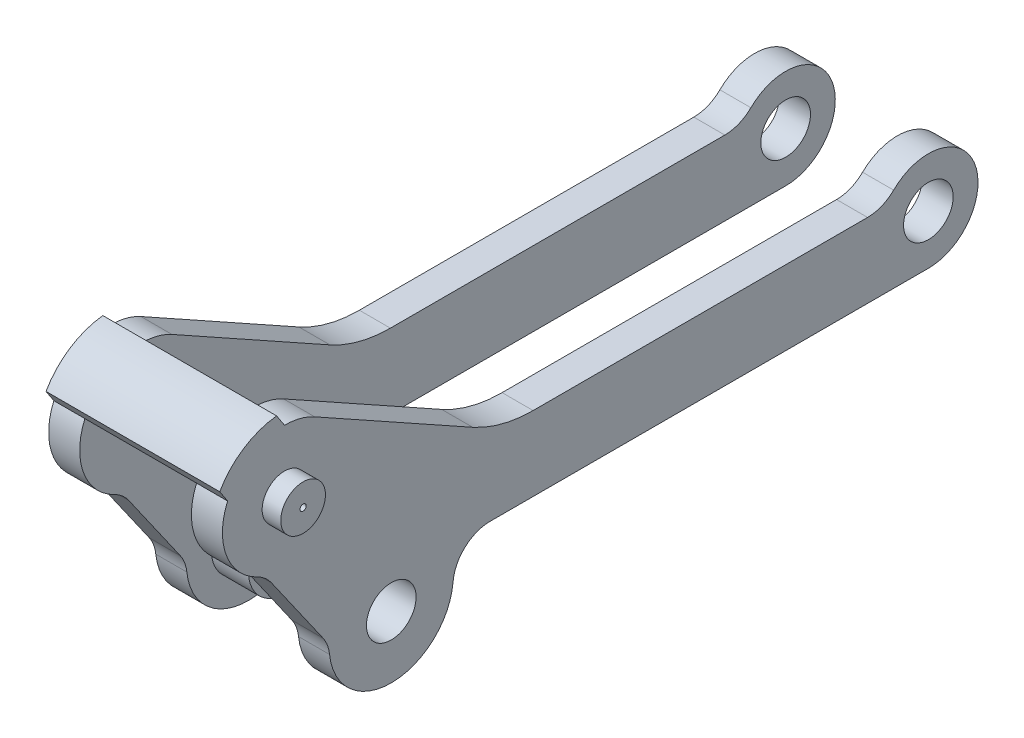
from build123d import *

# Parameters (mm, degrees)
EXTRUDE_1_DEPTH          = 2.5
SKETCH_1_4_R             = 3
EXTRUDE_2_DEPTH          = 3
CUT_EXTRUDE_1_DEPTH      = 51.090903435
CUT_EXTRUDE_1_DEPTH_BACK = 51.090903435
SKETCH_1_3_R             = 2
FILLET_1_R               = 3
EXTRUDE_START            = -2.5
SKETCH_2_R               = 2
EXTRUDE_3_DEPTH          = 2.5
SKETCH_2_3_R             = 1.8
EXTRUDE_4_DEPTH          = 1.5
EXTRUDE_6_DEPTH          = 2.5
EXTRUDE_START_2          = -7
EXTRUDE_5_DEPTH          = 7
FILLET_3_R               = 10
SKETCH_5_R               = 0.25
CUT_EXTRUDE_2_DEPTH      = 2


with BuildPart() as part:
    # 草图1 → 凸台-拉伸1 (new body)
    with BuildSketch(Plane(origin=(0, 0, 0), x_dir=(0, 0, -1), z_dir=(1, 0, 0))):
        with BuildLine():
            Line((40.737143614, 0), (0, 0))
            Line((0, 0), (2.48051592, -3.542543867))
            ThreePointArc((2.48051592, -3.542543867), (4.165783411, -4.487079684), (5.367176995, -6))
            Line((5.367176995, -6), (44.201245229, -6))
            ThreePointArc((44.201245229, -6), (40.737143614, -4), (40.737143614, 0))
        make_face()
        with BuildLine():
            Line((2.48051592, -3.542543867), (0, 0))
            Line((0, 0), (-2.681672007, 3.829824531))
            ThreePointArc((-2.681672007, 3.829824531), (-4.811127311, -0.102785303), (-9.234888361, -0.758786959))
            Line((-9.234888361, -0.758786959), (-4.072700434, -8.131155358))
            ThreePointArc((-4.072700434, -8.131155358), (-1.94324513, -4.198545524), (2.48051592, -3.542543867))
        make_face()
        with BuildLine():
            ThreePointArc((48.201245229, -2), (45.23652141, 1.863703305), (40.737143614, 0))
            Line((40.737143614, 0), (44.201245229, 0))
            ThreePointArc((44.201245229, 0), (45.615458792, -0.585786438), (46.201245229, -2))
            ThreePointArc((46.201245229, -2), (45.615458792, -3.414213562), (44.201245229, -4))
            Line((44.201245229, -4), (44.201245229, -6))
            ThreePointArc((44.201245229, -6), (47.029672354, -4.828427125), (48.201245229, -2))
        make_face()
        with BuildLine():
            Line((44.201245229, 0), (40.737143614, 0))
            ThreePointArc((40.737143614, 0), (40.737143614, -4), (44.201245229, -6))
            Line((44.201245229, -6), (44.201245229, -4))
            ThreePointArc((44.201245229, -4), (42.201245229, -2), (44.201245229, 0))
        make_face()
        with BuildLine():
            ThreePointArc((5.367176995, -6), (4.165783411, -4.487079684), (2.48051592, -3.542543867))
            Line((2.48051592, -3.542543867), (4.201245229, -6))
            Line((4.201245229, -6), (5.367176995, -6))
        make_face()
        with BuildLine():
            Line((4.201245229, -6), (2.48051592, -3.542543867))
            ThreePointArc((2.48051592, -3.542543867), (-1.94324513, -4.198545524), (-4.072700434, -8.131155358))
            Line((-4.072700434, -8.131155358), (-2.351971125, -10.588611491))
            Line((-2.351971125, -10.588611491), (-1.532819081, -10.015035054))
            ThreePointArc((-1.532819081, -10.015035054), (-0.796092257, -5.836849613), (3.382093185, -6.573576436))
            Line((3.382093185, -6.573576436), (4.201245229, -6))
        make_face()
        with BuildLine():
            ThreePointArc((-9.234888361, -0.758786959), (-4.811127311, -0.102785303), (-2.681672007, 3.829824531))
            Line((-2.681672007, 3.829824531), (-4.402401316, 6.287280664))
            Line((-4.402401316, 6.287280664), (-6.040705405, 5.140127792))
            ThreePointArc((-6.040705405, 5.140127792), (-5.771575592, 4.594386518), (-5.679009493, 3.992974919))
            ThreePointArc((-5.679009493, 3.992974919), (-7.077597894, 2.085541017), (-9.317313582, 2.845822046))
            Line((-9.317313582, 2.845822046), (-10.95561767, 1.698669174))
            Line((-10.95561767, 1.698669174), (-9.234888361, -0.758786959))
        make_face()
        with BuildLine():
            Line((-4.402401316, 6.287280664), (-2.681672007, 3.829824531))
            ThreePointArc((-2.681672007, 3.829824531), (-2.679675166, 3.911388863), (-2.679009493, 3.992974919))
            ThreePointArc((-2.679009493, 3.992974919), (-10.613341245, 8.041394014), (-9.234888361, -0.758786959))
            Line((-9.234888361, -0.758786959), (-10.95561767, 1.698669174))
            Line((-10.95561767, 1.698669174), (-9.317313582, 2.845822046))
            ThreePointArc((-9.317313582, 2.845822046), (-8.826162366, 5.631279008), (-6.040705405, 5.140127792))
            Line((-6.040705405, 5.140127792), (-4.402401316, 6.287280664))
        make_face()
        with BuildLine():
            ThreePointArc((46.201245229, -2), (45.615458792, -0.585786438), (44.201245229, 0))
            Line((44.201245229, 0), (44.201245229, -4))
            ThreePointArc((44.201245229, -4), (45.615458792, -3.414213562), (46.201245229, -2))
        make_face()
        with BuildLine():
            Line((44.201245229, -4), (44.201245229, 0))
            ThreePointArc((44.201245229, 0), (42.201245229, -2), (44.201245229, -4))
        make_face()
        with BuildLine():
            Line((5.367176995, -6), (4.201245229, -6))
            Line((4.201245229, -6), (3.382093185, -6.573576436))
            ThreePointArc((3.382093185, -6.573576436), (3.785787904, -7.392188347), (3.924637052, -8.294305745))
            ThreePointArc((3.924637052, -8.294305745), (1.826754451, -11.155456598), (-1.532819081, -10.015035054))
            Line((-1.532819081, -10.015035054), (-2.351971125, -10.588611491))
            Line((-2.351971125, -10.588611491), (-4.072700434, -8.131155358))
            ThreePointArc((-4.072700434, -8.131155358), (0.843050996, -13.293640073), (5.924637052, -8.294305745))
            ThreePointArc((5.924637052, -8.294305745), (5.783273678, -7.113776143), (5.367176995, -6))
        make_face()
        with BuildLine():
            ThreePointArc((3.924637052, -8.294305745), (3.785787904, -7.392188347), (3.382093185, -6.573576436))
            Line((3.382093185, -6.573576436), (2.562941141, -7.147152873))
            ThreePointArc((2.562941141, -7.147152873), (2.832070954, -7.692894146), (2.924637052, -8.294305745))
            ThreePointArc((2.924637052, -8.294305745), (1.526048651, -10.201739647), (-0.713667036, -9.441458618))
            Line((-0.713667036, -9.441458618), (-1.532819081, -10.015035054))
            ThreePointArc((-1.532819081, -10.015035054), (1.826754451, -11.155456598), (3.924637052, -8.294305745))
        make_face()
        with BuildLine():
            Line((2.562941141, -7.147152873), (3.382093185, -6.573576436))
            ThreePointArc((3.382093185, -6.573576436), (-0.796092257, -5.836849613), (-1.532819081, -10.015035054))
            Line((-1.532819081, -10.015035054), (-0.713667036, -9.441458618))
            ThreePointArc((-0.713667036, -9.441458618), (-0.222515821, -6.656001657), (2.562941141, -7.147152873))
        make_face()
        with BuildLine():
            ThreePointArc((-5.679009493, 3.992974919), (-5.771575592, 4.594386518), (-6.040705405, 5.140127792))
            Line((-6.040705405, 5.140127792), (-9.317313582, 2.845822046))
            ThreePointArc((-9.317313582, 2.845822046), (-7.077597894, 2.085541017), (-5.679009493, 3.992974919))
        make_face()
        with BuildLine():
            Line((-9.317313582, 2.845822046), (-6.040705405, 5.140127792))
            ThreePointArc((-6.040705405, 5.140127792), (-8.826162366, 5.631279008), (-9.317313582, 2.845822046))
        make_face()
        with BuildLine():
            ThreePointArc((2.924637052, -8.294305745), (2.832070954, -7.692894146), (2.562941141, -7.147152873))
            Line((2.562941141, -7.147152873), (-0.713667036, -9.441458618))
            ThreePointArc((-0.713667036, -9.441458618), (1.526048651, -10.201739647), (2.924637052, -8.294305745))
        make_face()
        with BuildLine():
            Line((-0.713667036, -9.441458618), (2.562941141, -7.147152873))
            ThreePointArc((2.562941141, -7.147152873), (-0.222515821, -6.656001657), (-0.713667036, -9.441458618))
        make_face()
    extrude(amount=EXTRUDE_1_DEPTH)

    # 草图1<4> → 凸台-拉伸2 (add)
    with BuildSketch(Plane(origin=(0, 0, 0), x_dir=(0, 0, -1), z_dir=(1, 0, 0))):
        with Locations((0.924637052, -8.294305745)):
            Circle(SKETCH_1_4_R)
    extrude(amount=-EXTRUDE_2_DEPTH)

    # 草图1<3> → 切除-拉伸1 (cut, two sides: drawn at the far end of the back side and taken through both)
    with BuildSketch(Plane(origin=(0, 0, 0), x_dir=(0, 0, -1), z_dir=(1, 0, 0)).offset(-CUT_EXTRUDE_1_DEPTH_BACK)):
        with Locations((-7.679009493, 3.992974919)):
            Circle(SKETCH_1_3_R)
        with Locations((44.201245229, -2)):
            Circle(SKETCH_1_3_R)
        with Locations((0.924637052, -8.294305745)):
            Circle(SKETCH_1_3_R)
    extrude(amount=CUT_EXTRUDE_1_DEPTH + CUT_EXTRUDE_1_DEPTH_BACK, mode=Mode.SUBTRACT)

    # 圆角1
    fillet_1_edges = [part.edges().sort_by_distance(p)[0] for p in [
        (1.25, -6, -5.367176995),
        (1.25, 0, 0),
        (1.25, 0, -40.737143614),
        (1.25, -0.758786959, 9.234888361),
        (1.25, -8.131155358, 4.072700434),
    ]]
    fillet(fillet_1_edges, radius=FILLET_1_R)

    # 草图2 → 凸台-拉伸3 (add)
    with BuildSketch(Plane(origin=(2.5, 0, 0), x_dir=(0, 0, -1), z_dir=(1, 0, 0)).offset(EXTRUDE_START)):
        with Locations((-7.679009493, 3.992974919)):
            Circle(SKETCH_2_R)
    extrude(amount=EXTRUDE_3_DEPTH)

    # 草图2<3> → 凸台-拉伸4 (add)
    with BuildSketch(Plane(origin=(2.5, 0, 0), x_dir=(0, 0, -1), z_dir=(1, 0, 0))):
        with Locations((-7.679009493, 3.992974919)):
            Circle(SKETCH_2_3_R)
    extrude(amount=EXTRUDE_4_DEPTH)

    # 草图4 → 凸台-拉伸6 (add)
    with BuildSketch(Plane(origin=(2.5, 0, 0), x_dir=(0, 0, -1), z_dir=(1, 0, 0))):
        Polygon((-5.244772745, 8.360410259), (9.755227255, 0), (-5.244772745, 0), align=None)
    extrude(amount=-EXTRUDE_6_DEPTH)

    # 草图3 → 凸台-拉伸5 (add)
    with BuildSketch(Plane(origin=(2.5, 0, 0), x_dir=(0, 0, -1), z_dir=(1, 0, 0)).offset(EXTRUDE_START_2)):
        with BuildLine():
            Line((-12.894335644, 6.959517206), (-12.261585188, 5.992974919))
            ThreePointArc((-12.261585188, 5.992974919), (-10.417622281, 8.176275052), (-7.679009493, 8.992974919))
            Line((-7.679009493, 8.992974919), (-8.311759949, 9.959517206))
            ThreePointArc((-8.311759949, 9.959517206), (-10.965344838, 9.012935078), (-12.894335644, 6.959517206))
        make_face()
    extrude(amount=EXTRUDE_5_DEPTH)

    # 圆角3
    fillet_3_edges = [part.edges().sort_by_distance(p)[0] for p in [
        (1.25, 0, -9.755227255),
    ]]
    fillet(fillet_3_edges, radius=FILLET_3_R)

    # 镜向1: part across plane


with BuildPart() as part_1:
    add(part.part)
    add(part.part.mirror(Plane.ZY.offset(4.5)))

    # 草图5 → 切除-拉伸2 (cut)
    with BuildSketch(Plane(origin=(4, 0, 0), x_dir=(0, 0, -1), z_dir=(1, 0, 0))):
        with Locations((-7.679009493, 3.992974919)):
            Circle(SKETCH_5_R)
    extrude(amount=-CUT_EXTRUDE_2_DEPTH, mode=Mode.SUBTRACT)


solid = part_1.part
